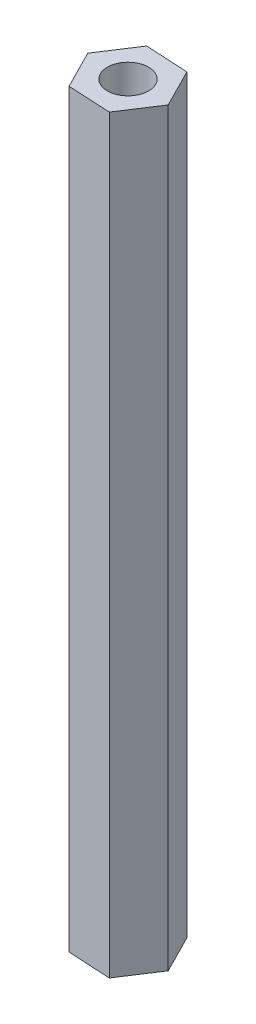
from build123d import *

# Parameters (mm, degrees)
EXTRUDE_1_DEPTH    = 60
HOLE_WIZARD_M4_1_D = 3.3


with BuildPart() as part:
    # 草图1 → 凸台-拉伸1 (new body)
    with BuildSketch(Plane(origin=(0, 0, 0), x_dir=(1, 0, 0), z_dir=(0, 1, 0))):
        Polygon((3.401504202, -0.181940922), (1.858317562, 2.854818589), (-1.54318664, 3.036759511), (-3.401504202, 0.181940922), (-1.858317562, -2.854818589), (1.54318664, -3.036759511), align=None)
    extrude(amount=EXTRUDE_1_DEPTH)

    # M4 螺纹孔1 (through all)
    with Locations(Plane(origin=(0, 60, 0), x_dir=(1, 0, 0), z_dir=(0, 1, 0))):
        with Locations((0, 0)):
            Hole(HOLE_WIZARD_M4_1_D / 2)


solid = part.part
